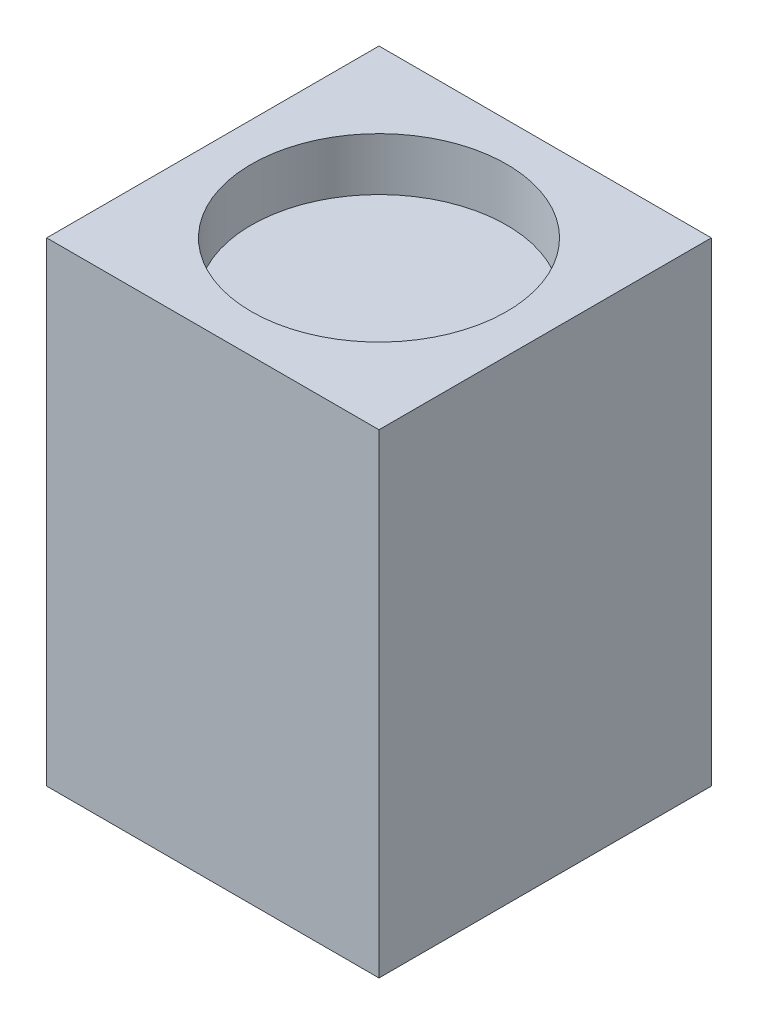
from build123d import *

# Parameters (mm, degrees)
BOSS_EXTRUDE1_DEPTH = 228.6
SKETCH3_R           = 61.468
CUT_EXTRUDE1_DEPTH  = 25.4


with BuildPart() as part:
    # Sketch1 → Boss-Extrude1 (new body)
    with BuildSketch(Plane(origin=(0, 0, 0), x_dir=(1, 0, 0), z_dir=(0, 1, 0))):
        Polygon((0, 80), (-80, 80), (-80, 0), (-80, -80), (0, -80), (80, -80), (80, 0), (80, 80), align=None)
    extrude(amount=BOSS_EXTRUDE1_DEPTH)

    # Sketch3 → Cut-Extrude1 (cut)
    with BuildSketch(Plane(origin=(0, 228.6, 0), x_dir=(1, 0, 0), z_dir=(0, 1, 0))):
        with Locations(Location((0, 0, 0), (0, 0, 270))):
            Circle(SKETCH3_R)
    extrude(amount=-CUT_EXTRUDE1_DEPTH, mode=Mode.SUBTRACT)


solid = part.part
